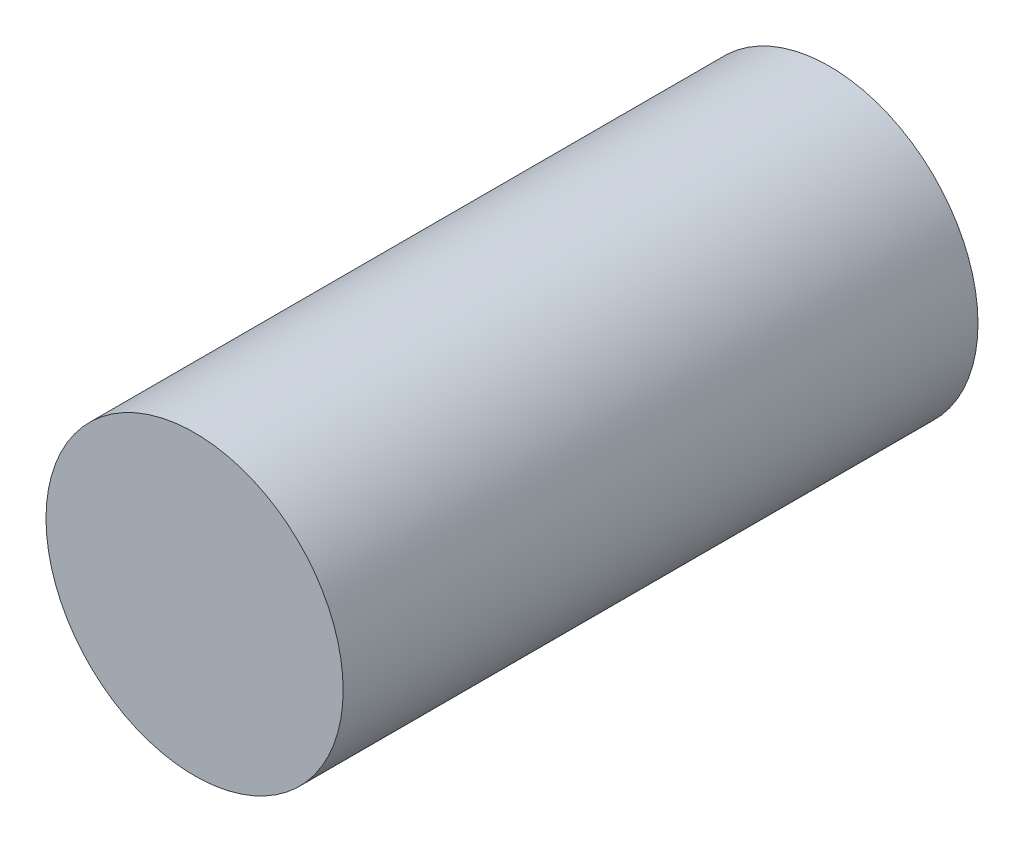
from build123d import *

# Parameters (mm, degrees)
ESQUISSE1_R        = 11
BOSS_EXTRU_1_DEPTH = 47


with BuildPart() as part:
    # Esquisse1 → Boss.-Extru.1 (new body)
    with BuildSketch(Plane.XY):
        Circle(ESQUISSE1_R)
    extrude(amount=BOSS_EXTRU_1_DEPTH)


solid = part.part
